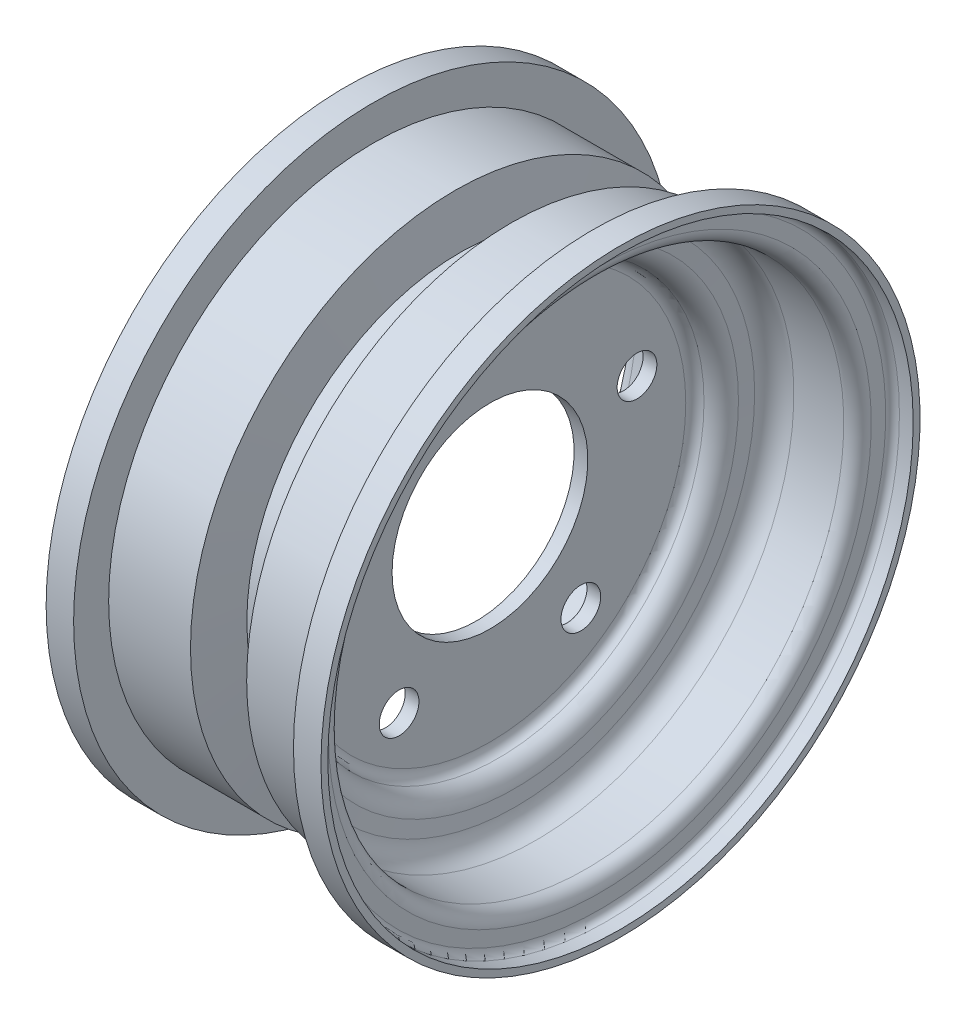
from build123d import *

# Parameters (mm, degrees)
F_37_64_0_57813_DIAMETER_HOLE1_D = 14.684502
FILLET1_R                        = 3.81
FILLET2_R                        = 7.62
FILLET3_R                        = 5.08
FILLET4_R                        = 2.54


with BuildPart() as part:
    # Sketch2 → Revolve2 (revolve)
    with BuildSketch(Plane.XY, mode=Mode.PRIVATE) as revolve2_sk:
        Polygon((48.26, 110.744), (50.8, 110.744), (50.8, 108.204), (43.18, 108.204), (43.18, 95.25), (12.7, 95.25), (10.922, 76.2), (2.54, 76.2), (2.54, 36.195), (0, 36.195), (0, 78.74), (8.608027544, 78.74), (10.386027544, 97.79), (40.64, 97.79), (40.64, 110.744), align=None)
    revolve2 = revolve(revolve2_sk.sketch.rotate(Axis((0, 0, 0), (1, 0, 0)), 90), axis=Axis((0, 0, 0), (1, 0, 0)))

    # Mirror1: Revolve2 across plane
    add(revolve2.mirror(Plane(origin=(0, 0, 0), x_dir=(0, 0, 1), z_dir=(1, 0, 0))))

    # 37/64 (0.57813) Diameter Hole1 (through all)
    with Locations(Plane(origin=(2.54, 0, 0), x_dir=(0, 0, -1), z_dir=(1, 0, 0))):
        with Locations((0, 57.15), (54.352879906, 17.660321229), (33.591927169, -46.235321229), (-33.591927169, -46.235321229), (-54.352879906, 17.660321229)):
            Hole(F_37_64_0_57813_DIAMETER_HOLE1_D / 2)

    # Fillet1
    fillet1_edges = [part.edges().sort_by_distance(p)[0] for p in [
        (2.54, 0, -76.2),
        (-2.54, 0, -76.2),
    ]]
    fillet(fillet1_edges, radius=FILLET1_R)

    # Fillet2
    fillet2_edges = [part.edges().sort_by_distance(p)[0] for p in [
        (12.7, 0, -95.25),
        (10.922, 0, -76.2),
        (-12.7, 0, -95.25),
        (-10.922, 0, -76.2),
    ]]
    fillet(fillet2_edges, radius=FILLET2_R)

    # Fillet3
    fillet3_edges = [part.edges().sort_by_distance(p)[0] for p in [
        (43.18, 0, -95.25),
        (-43.18, 0, -95.25),
    ]]
    fillet(fillet3_edges, radius=FILLET3_R)

    # Fillet4
    fillet4_edges = [part.edges().sort_by_distance(p)[0] for p in [
        (43.18, 0, -108.204),
        (-43.18, 0, -108.204),
    ]]
    fillet(fillet4_edges, radius=FILLET4_R)


solid = part.part
